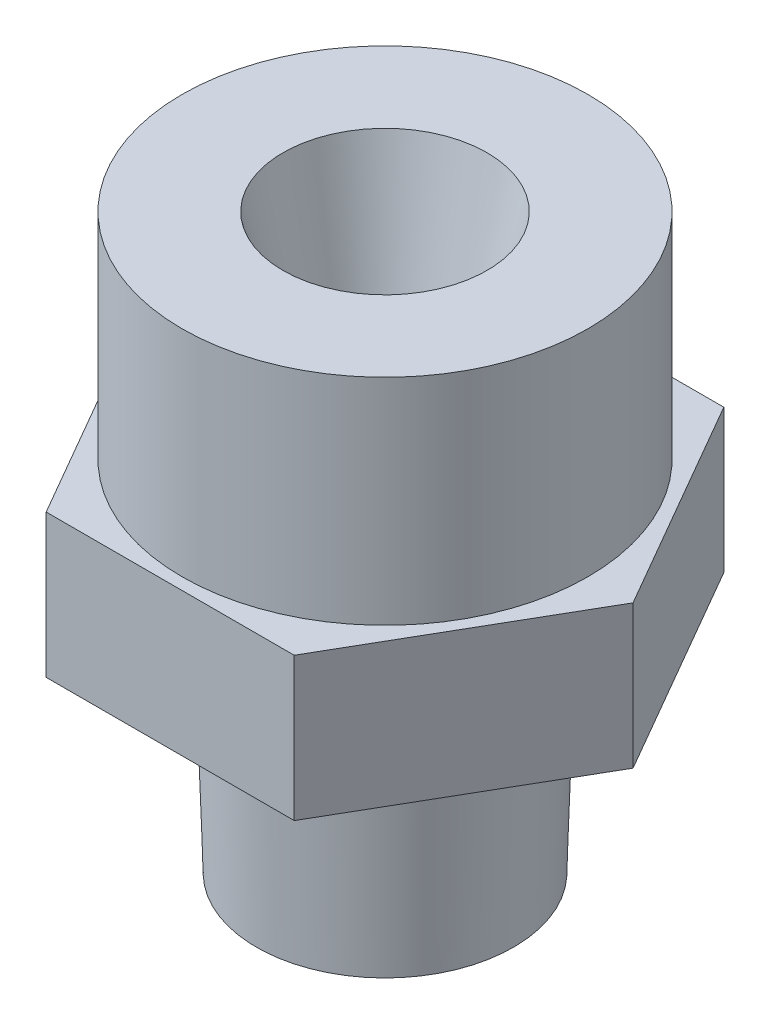
from build123d import *

# Parameters (mm, degrees)
SKETCH1_R           = 9
BOSS_EXTRUDE1_DEPTH = 9.525
SKETCH4_R           = 3.175
CUT_EXTRUDE1_DEPTH  = 3.175
SKETCH5_R           = 3.175
CUT_EXTRUDE2_DEPTH  = 15.224011389
CUT_EXTRUDE2_DRAFT  = 12
BOSS_EXTRUDE3_START = 6.35
SKETCH6_R           = 3.175
BOSS_EXTRUDE3_DEPTH = 6.35
SKETCH7_R           = 6
BOSS_EXTRUDE4_DEPTH = 9.525
BOSS_EXTRUDE4_TAPER = 1.79
SKETCH8_R           = 3.175
CUT_EXTRUDE3_DEPTH  = 30.272053652


with BuildPart() as part:
    # Sketch1 → Boss-Extrude1 (new body)
    with BuildSketch(Plane(origin=(0, 0, 0), x_dir=(1, 0, 0), z_dir=(0, 1, 0))):
        with Locations(Location((0, 0, 0), (0, 0, 90))):
            Circle(SKETCH1_R)
    extrude(amount=BOSS_EXTRUDE1_DEPTH)

    # Sketch4 → Cut-Extrude1 (cut)
    with BuildSketch(Plane.XZ):
        with Locations(Location((0, 0, 0), (0, 0, 270))):
            Circle(SKETCH4_R)
    extrude(amount=-CUT_EXTRUDE1_DEPTH, mode=Mode.SUBTRACT)


with BuildPart() as cut_extrude2_tool:
    # Sketch5 → Cut-Extrude2 (with draft: the straight prism first)
    with BuildSketch(Plane(origin=(0, 3.175, 0), x_dir=(-1, 0, 0), z_dir=(0, -1, 0))):
        with Locations(Location((0, 0, 0), (0, 0, 90))):
            Circle(SKETCH5_R)
    extrude(amount=-CUT_EXTRUDE2_DEPTH)
    # Cut-Extrude2: the draft: its side faces are tilted about the plane it starts from
    cut_extrude2_sides = [cut_extrude2_tool.faces().sort_by_distance(p)[0] for p in [
        (0, 10.787005695, 3.175),
    ]]
    draft(cut_extrude2_sides, Plane(origin=(0, 3.175, 0), x_dir=(-1, 0, 0), z_dir=(0, -1, 0)), CUT_EXTRUDE2_DRAFT)


with BuildPart() as part_1:
    add(part.part)

    # Cut-Extrude2: cut by cut_extrude2_tool
    add(cut_extrude2_tool.part, mode=Mode.SUBTRACT)

    # Sketch6 → Boss-Extrude3 (add)
    with BuildSketch(Plane.XZ.offset(BOSS_EXTRUDE3_START)):
        Polygon((-10.998522628, 0), (-5.499261314, -9.525), (5.499261314, -9.525), (10.998522628, 0), (5.499261314, 9.525), (-5.499261314, 9.525), align=None)
        with Locations(Location((0, 0, 0), (0, 0, 270))):
            Circle(SKETCH6_R, mode=Mode.SUBTRACT)
    extrude(amount=-BOSS_EXTRUDE3_DEPTH)

    # Sketch7 → Boss-Extrude4 (add)
    with BuildSketch(Plane.XZ.offset(6.35)):
        Circle(SKETCH7_R)
    extrude(amount=BOSS_EXTRUDE4_DEPTH, taper=BOSS_EXTRUDE4_TAPER)

    # Sketch8 → Cut-Extrude3 (cut, through all)
    with BuildSketch(Plane.XZ.offset(15.875)):
        with Locations(Location((0, 0, 0), (0, 0, 270))):
            Circle(SKETCH8_R)
    extrude(amount=-CUT_EXTRUDE3_DEPTH, mode=Mode.SUBTRACT)


solid = part_1.part
